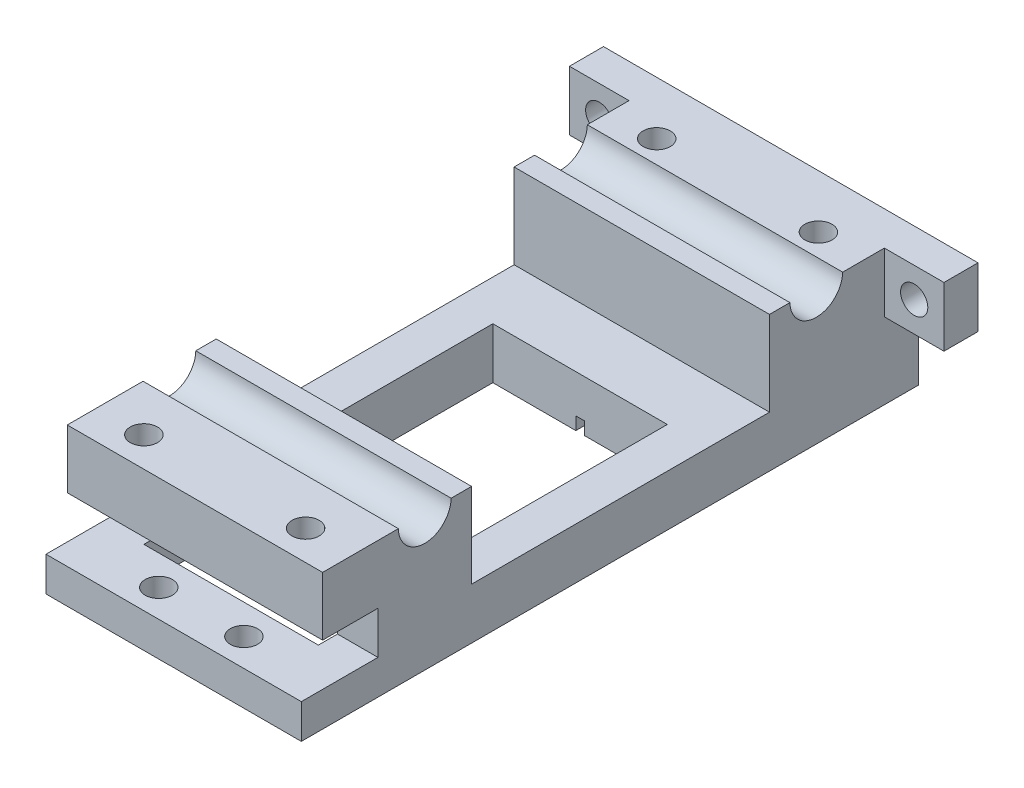
from build123d import *

# Parameters (mm, degrees)
SKETCH3_W           = 30
SKETCH3_H           = 72.5
BOSS_EXTRUDE2_DEPTH = 15.95
SKETCH7_W           = 20.5
SKETCH7_H           = 41
CUT_EXTRUDE5_DEPTH  = 8.1
SKETCH8_W           = 30
SKETCH8_H           = 35
CUT_EXTRUDE6_DEPTH  = 9.95
CUT_EXTRUDE7_DEPTH  = 50.683649222
SKETCH10_R          = 3.1
CUT_EXTRUDE8_DEPTH  = 50.683649222
CUT_EXTRUDE9_REACH  = 44.349
SKETCH11_R          = 1.6
CUT_EXTRUDE10_REACH = 42.996
SKETCH12_R          = 1.6
SKETCH13_W          = 7
SKETCH13_H          = 7
SKETCH13_R          = 1.6
BOSS_EXTRUDE3_DEPTH = 4
CUT_EXTRUDE11_DEPTH = 0.5


with BuildPart() as part:
    # Sketch3 → Boss-Extrude2 (new body)
    with BuildSketch(Plane(origin=(0, 0, 0), x_dir=(1, 0, 0), z_dir=(0, 1, 0))):
        Rectangle(SKETCH3_W, SKETCH3_H)
    extrude(amount=BOSS_EXTRUDE2_DEPTH)

    # Sketch7 → Cut-Extrude5 (cut)
    with BuildSketch(Plane.XZ):
        with Locations((0, 9)):
            Rectangle(SKETCH7_W, SKETCH7_H)
    extrude(amount=-CUT_EXTRUDE5_DEPTH, mode=Mode.SUBTRACT)

    # Sketch8 → Cut-Extrude6 (cut)
    with BuildSketch(Plane(origin=(0, 15.95, 0), x_dir=(1, 0, 0), z_dir=(0, 1, 0))):
        with Locations((0, 1.25)):
            Rectangle(SKETCH8_W, SKETCH8_H)
    extrude(amount=-CUT_EXTRUDE6_DEPTH, mode=Mode.SUBTRACT)

    # Sketch9 → Cut-Extrude7 (cut, through all)
    with BuildSketch(Plane(origin=(15, 0, 0), x_dir=(0, 0, -1), z_dir=(1, 0, 0))):
        Polygon((-36.25, 15.95), (-33.75, 15.95), (-33.75, 9.05), (-27.25, 9.05), (-27.25, 4.05), (-36.25, 4.05), align=None)
    extrude(amount=-CUT_EXTRUDE7_DEPTH, mode=Mode.SUBTRACT)

    # Sketch10 → Cut-Extrude8 (cut, through all)
    with BuildSketch(Plane(origin=(15, 0, 0), x_dir=(0, 0, -1), z_dir=(1, 0, 0))):
        with Locations((24.25, 16)):
            Circle(SKETCH10_R)
        with Locations((-21.75, 16)):
            Circle(SKETCH10_R)
    extrude(amount=-CUT_EXTRUDE8_DEPTH, mode=Mode.SUBTRACT)

    # Sketch11 → Cut-Extrude9 (cut, up to next)
    with BuildSketch(Plane(origin=(0, 15.95, 0), x_dir=(1, 0, 0), z_dir=(0, 1, 0)), mode=Mode.PRIVATE) as cut_extrude9_sk1:
        with Locations(Location((-9.5, -30.25, 0), (0, 0, 270))):
            Circle(SKETCH11_R)
    cut_extrude9_tool1 = extrude(cut_extrude9_sk1.sketch, amount=-CUT_EXTRUDE9_REACH, mode=Mode.PRIVATE) & part.part
    # Sketch11 → Cut-Extrude9 (cut, up to next)
    with BuildSketch(Plane(origin=(0, 15.95, 0), x_dir=(1, 0, 0), z_dir=(0, 1, 0)), mode=Mode.PRIVATE) as cut_extrude9_sk2:
        with Locations(Location((9.5, -30.25, 0), (0, 0, 270))):
            Circle(SKETCH11_R)
    cut_extrude9_tool2 = extrude(cut_extrude9_sk2.sketch, amount=-CUT_EXTRUDE9_REACH, mode=Mode.PRIVATE) & part.part
    # Sketch11 → Cut-Extrude9 (cut, up to next)
    with BuildSketch(Plane(origin=(0, 15.95, 0), x_dir=(1, 0, 0), z_dir=(0, 1, 0)), mode=Mode.PRIVATE) as cut_extrude9_sk3:
        with Locations(Location((-9.5, 30, 0), (0, 0, 270))):
            Circle(SKETCH11_R)
    cut_extrude9_tool3 = extrude(cut_extrude9_sk3.sketch, amount=-CUT_EXTRUDE9_REACH, mode=Mode.PRIVATE) & part.part
    # Sketch11 → Cut-Extrude9 (cut, up to next)
    with BuildSketch(Plane(origin=(0, 15.95, 0), x_dir=(1, 0, 0), z_dir=(0, 1, 0)), mode=Mode.PRIVATE) as cut_extrude9_sk4:
        with Locations(Location((9.5, 30, 0), (0, 0, 270))):
            Circle(SKETCH11_R)
    cut_extrude9_tool4 = extrude(cut_extrude9_sk4.sketch, amount=-CUT_EXTRUDE9_REACH, mode=Mode.PRIVATE) & part.part
    add(cut_extrude9_tool1.solids().sort_by_distance((-9.5, 15.95, 30.25))[0], mode=Mode.SUBTRACT)
    add(cut_extrude9_tool2.solids().sort_by_distance((9.5, 15.95, 30.25))[0], mode=Mode.SUBTRACT)
    add(cut_extrude9_tool3.solids().sort_by_distance((-9.5, 15.95, -30))[0], mode=Mode.SUBTRACT)
    add(cut_extrude9_tool4.solids().sort_by_distance((9.5, 15.95, -30))[0], mode=Mode.SUBTRACT)

    # Sketch12 → Cut-Extrude10 (cut, up to next)
    with BuildSketch(Plane(origin=(0, 4.05, 0), x_dir=(1, 0, 0), z_dir=(0, 1, 0)), mode=Mode.PRIVATE) as cut_extrude10_sk1:
        with Locations(Location((-5, -33, 0), (0, 0, 270))):
            Circle(SKETCH12_R)
    cut_extrude10_tool1 = extrude(cut_extrude10_sk1.sketch, amount=-CUT_EXTRUDE10_REACH, mode=Mode.PRIVATE) & part.part
    # Sketch12 → Cut-Extrude10 (cut, up to next)
    with BuildSketch(Plane(origin=(0, 4.05, 0), x_dir=(1, 0, 0), z_dir=(0, 1, 0)), mode=Mode.PRIVATE) as cut_extrude10_sk2:
        with Locations(Location((5, -33, 0), (0, 0, 270))):
            Circle(SKETCH12_R)
    cut_extrude10_tool2 = extrude(cut_extrude10_sk2.sketch, amount=-CUT_EXTRUDE10_REACH, mode=Mode.PRIVATE) & part.part
    # Sketch12 → Cut-Extrude10 (cut, up to next)
    with BuildSketch(Plane(origin=(0, 4.05, 0), x_dir=(1, 0, 0), z_dir=(0, 1, 0)), mode=Mode.PRIVATE) as cut_extrude10_sk3:
        with Locations(Location((-5, 15, 0), (0, 0, 270))):
            Circle(SKETCH12_R)
    cut_extrude10_tool3 = extrude(cut_extrude10_sk3.sketch, amount=-CUT_EXTRUDE10_REACH, mode=Mode.PRIVATE) & part.part
    # Sketch12 → Cut-Extrude10 (cut, up to next)
    with BuildSketch(Plane(origin=(0, 4.05, 0), x_dir=(1, 0, 0), z_dir=(0, 1, 0)), mode=Mode.PRIVATE) as cut_extrude10_sk4:
        with Locations(Location((5, 15, 0), (0, 0, 270))):
            Circle(SKETCH12_R)
    cut_extrude10_tool4 = extrude(cut_extrude10_sk4.sketch, amount=-CUT_EXTRUDE10_REACH, mode=Mode.PRIVATE) & part.part
    add(cut_extrude10_tool1.solids().sort_by_distance((-5, 4.05, 33))[0], mode=Mode.SUBTRACT)
    add(cut_extrude10_tool2.solids().sort_by_distance((5, 4.05, 33))[0], mode=Mode.SUBTRACT)
    add(cut_extrude10_tool3.solids().sort_by_distance((-5, 4.05, -15))[0], mode=Mode.SUBTRACT)
    add(cut_extrude10_tool4.solids().sort_by_distance((5, 4.05, -15))[0], mode=Mode.SUBTRACT)

    # Sketch13 → Boss-Extrude3 (add)
    # profile 1 of 2: a face of its own
    with BuildSketch(Plane(origin=(0, 0, -36.25), x_dir=(-1, 0, 0), z_dir=(0, 0, -1))):
        with Locations((18.5, 12.45)):
            Rectangle(SKETCH13_W, SKETCH13_H)
        with Locations((18.5, 12.45)):
            Circle(SKETCH13_R, mode=Mode.SUBTRACT)
    # profile 2 of 2: a face of its own
    with BuildSketch(Plane(origin=(0, 0, -36.25), x_dir=(-1, 0, 0), z_dir=(0, 0, -1))):
        with Locations((-18.5, 12.45)):
            Rectangle(SKETCH13_W, SKETCH13_H)
        with Locations((-18.5, 12.45)):
            Circle(SKETCH13_R, mode=Mode.SUBTRACT)
    extrude(amount=-BOSS_EXTRUDE3_DEPTH)

    # Sketch14 → Cut-Extrude11 (cut, symmetric)
    with BuildSketch(Plane(origin=(0, 0, 0), x_dir=(0, 0, -1), z_dir=(1, 0, 0))):
        Polygon((18.3, 0), (11.5, 0), (11.5, 1.5), align=None)
        Polygon((-36.3, 0), (-29.5, 1.5), (-29.5, 0), align=None)
    extrude(amount=CUT_EXTRUDE11_DEPTH, both=True, mode=Mode.SUBTRACT)


solid = part.part
